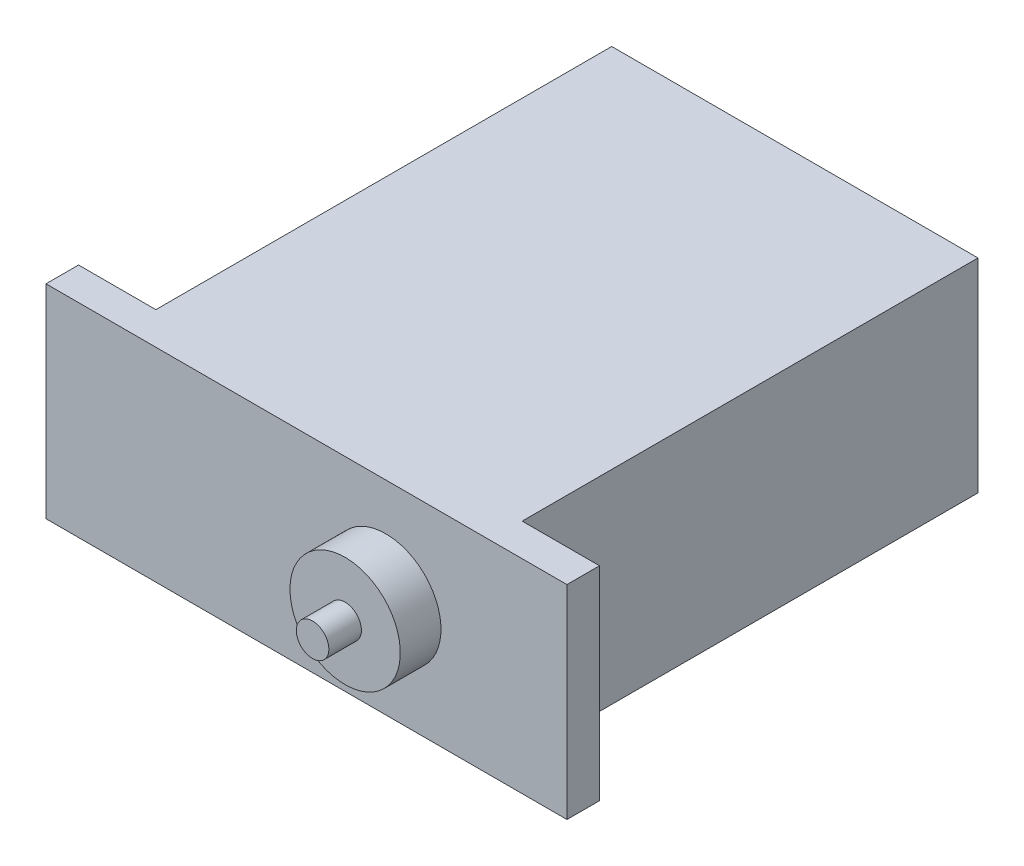
from build123d import *

# Parameters (mm, degrees)
SKETCH_1_W      = 22.5
SKETCH_1_H      = 12.5
EXTRUDE_1_DEPTH = 28
SKETCH_2_W      = 32
SKETCH_2_H      = 12.5
EXTRUDE_2_DEPTH = 2
SKETCH_3_R      = 3.388656212
EXTRUDE_3_DEPTH = 2.5
SKETCH_4_R      = 1
EXTRUDE_4_DEPTH = 2


with BuildPart() as part:
    # 草图1 → 凸台-拉伸1 (new body)
    with BuildSketch(Plane.XY):
        Rectangle(SKETCH_1_W, SKETCH_1_H)
    extrude(amount=EXTRUDE_1_DEPTH)

    # 草图2 → 凸台-拉伸2 (add)
    with BuildSketch(Plane.XY.offset(28)):
        Rectangle(SKETCH_2_W, SKETCH_2_H)
    extrude(amount=EXTRUDE_2_DEPTH)

    # 草图3 → 凸台-拉伸3 (add)
    with BuildSketch(Plane.XY.offset(30)):
        with Locations(Location((4.874315739, 0, 0), (0, 0, 180))):
            Circle(SKETCH_3_R)
    extrude(amount=EXTRUDE_3_DEPTH)

    # 草图4 → 凸台-拉伸4 (add)
    with BuildSketch(Plane.XY.offset(32.5)):
        with Locations((4.874315739, 0)):
            Circle(SKETCH_4_R)
    extrude(amount=EXTRUDE_4_DEPTH)


solid = part.part
